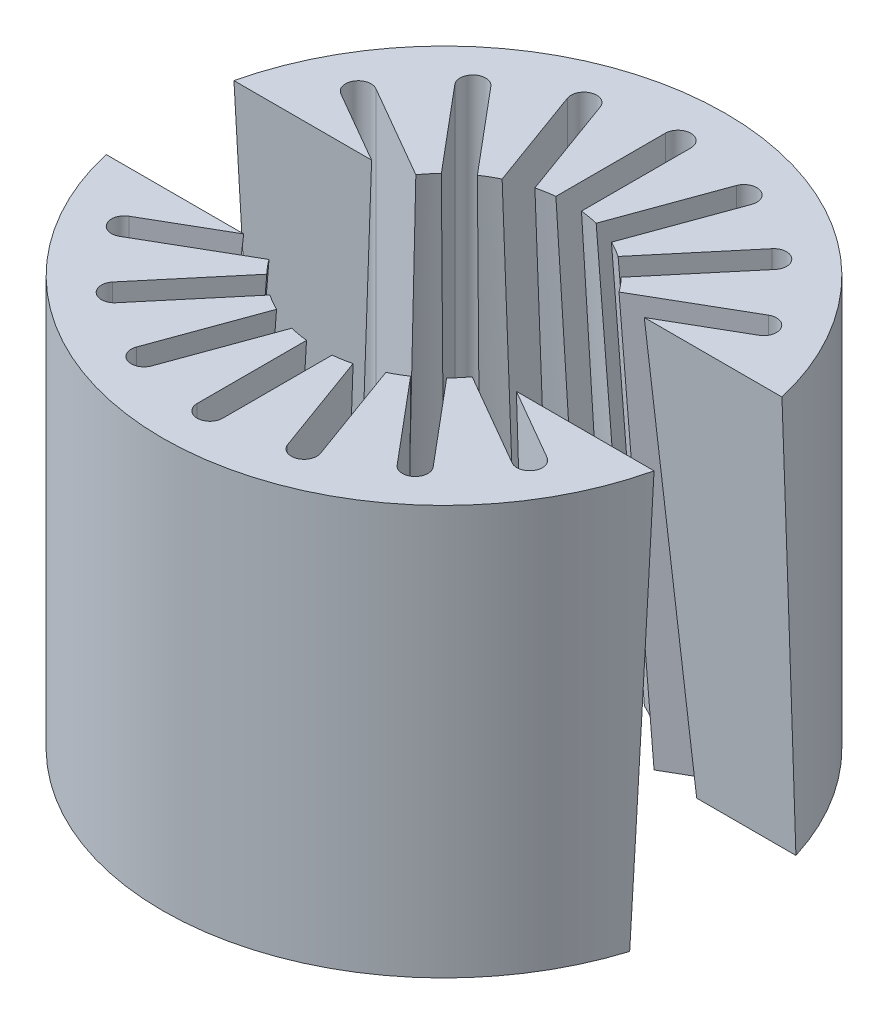
from build123d import *

# Parameters (mm, degrees)
SKETCH1_R           = 11
BOSS_EXTRUDE1_DEPTH = 16
CUT_EXTRUDE1_DEPTH  = 23.315913604
CUT_EXTRUDE2_DEPTH  = 15


with BuildPart() as part:
    # Sketch1 → Boss-Extrude1 (new body)
    with BuildSketch(Plane(origin=(0, 0, 0), x_dir=(1, 0, 0), z_dir=(0, 1, 0))):
        with Locations(Location((0, 0, 0), (0, 0, 270))):
            Circle(SKETCH1_R)
    extrude(amount=BOSS_EXTRUDE1_DEPTH)

    # Sketch2 → Cut-Revolve1 (revolve, cut)
    with BuildSketch(Plane(origin=(0, 0, 0), x_dir=(0, 0, -1), z_dir=(1, 0, 0))):
        Polygon((0, 0), (0, 16), (4.9, 16), (5.9, 0), align=None)
    revolve(axis=Axis((0, 0, 0), (0, 1, 0)), mode=Mode.SUBTRACT)

    # Sketch3 → Cut-Extrude1 (cut, through all)
    with BuildSketch(Plane(origin=(0, 16, 0), x_dir=(1, 0, 0), z_dir=(0, 1, 0))):
        with BuildLine():
            Line((-0.5, 4.8), (0.5, 4.8))
            Line((0.5, 4.8), (0.5, 9.15))
            ThreePointArc((0.5, 9.15), (0.353553391, 9.503553391), (0, 9.65))
            ThreePointArc((0, 9.65), (-0.353553391, 9.503553391), (-0.5, 9.15))
            Line((-0.5, 9.15), (-0.5, 4.8))
        make_face()
        with BuildLine():
            Line((1.171850378, 4.681534651), (2.111542998, 4.339514508))
            Line((2.111542998, 4.339514508), (3.599330622, 8.427177409))
            ThreePointArc((3.599330622, 8.427177409), (3.582638205, 8.809496611), (3.300494383, 9.068033791))
            ThreePointArc((3.300494383, 9.068033791), (2.918175181, 9.051341374), (2.659638001, 8.769197552))
            Line((2.659638001, 8.769197552), (1.171850378, 4.681534651))
        make_face()
        with BuildLine():
            Line((2.702358305, 3.998407132), (3.468402748, 3.355619522))
            Line((3.468402748, 3.355619522), (6.26452885, 6.68791285))
            ThreePointArc((6.26452885, 6.68791285), (6.379603978, 7.052884526), (6.202900433, 7.392328876))
            ThreePointArc((6.202900433, 7.392328876), (5.837928757, 7.507404004), (5.498484407, 7.330700459))
            Line((5.498484407, 7.330700459), (2.702358305, 3.998407132))
        make_face()
        with BuildLine():
            Line((3.906921938, 2.833012702), (4.406921938, 1.966987298))
            Line((4.406921938, 1.966987298), (8.174132445, 4.141987298))
            ThreePointArc((8.174132445, 4.141987298), (8.407095358, 4.445590477), (8.357145147, 4.825))
            ThreePointArc((8.357145147, 4.825), (8.053541967, 5.057962913), (7.674132445, 5.008012702))
            Line((7.674132445, 5.008012702), (3.906921938, 2.833012702))
        make_face()
        with BuildLine():
            Line((4.640253126, 1.325915129), (4.813901303, 0.341107376))
            Line((4.813901303, 0.341107376), (9.097815029, 1.096476949))
            ThreePointArc((9.097815029, 1.096476949), (9.420566962, 1.302092607), (9.503394817, 1.675704914))
            ThreePointArc((9.503394817, 1.675704914), (9.297779158, 1.998456848), (8.924166851, 2.081284702))
            Line((8.924166851, 2.081284702), (4.640253126, 1.325915129))
        make_face()
        with BuildLine():
            Line((4.813901303, -0.341107376), (4.640253126, -1.325915129))
            Line((4.640253126, -1.325915129), (8.924166851, -2.081284702))
            ThreePointArc((8.924166851, -2.081284702), (9.297779158, -1.998456848), (9.503394817, -1.675704914))
            ThreePointArc((9.503394817, -1.675704914), (9.420566962, -1.302092607), (9.097815029, -1.096476949))
            Line((9.097815029, -1.096476949), (4.813901303, -0.341107376))
        make_face()
        with BuildLine():
            Line((4.406921938, -1.966987298), (3.906921938, -2.833012702))
            Line((3.906921938, -2.833012702), (7.674132445, -5.008012702))
            ThreePointArc((7.674132445, -5.008012702), (8.053541967, -5.057962913), (8.357145147, -4.825))
            ThreePointArc((8.357145147, -4.825), (8.407095358, -4.445590477), (8.174132445, -4.141987298))
            Line((8.174132445, -4.141987298), (4.406921938, -1.966987298))
        make_face()
        with BuildLine():
            Line((3.468402748, -3.355619522), (2.702358305, -3.998407132))
            Line((2.702358305, -3.998407132), (5.498484407, -7.330700459))
            ThreePointArc((5.498484407, -7.330700459), (5.837928757, -7.507404004), (6.202900433, -7.392328876))
            ThreePointArc((6.202900433, -7.392328876), (6.379603978, -7.052884526), (6.26452885, -6.68791285))
            Line((6.26452885, -6.68791285), (3.468402748, -3.355619522))
        make_face()
        with BuildLine():
            Line((2.111542998, -4.339514508), (1.171850378, -4.681534651))
            Line((1.171850378, -4.681534651), (2.659638001, -8.769197552))
            ThreePointArc((2.659638001, -8.769197552), (2.918175181, -9.051341374), (3.300494383, -9.068033791))
            ThreePointArc((3.300494383, -9.068033791), (3.582638205, -8.809496611), (3.599330622, -8.427177409))
            Line((3.599330622, -8.427177409), (2.111542998, -4.339514508))
        make_face()
        with BuildLine():
            Line((0.5, -4.8), (-0.5, -4.8))
            Line((-0.5, -4.8), (-0.5, -9.15))
            ThreePointArc((-0.5, -9.15), (-0.353553391, -9.503553391), (0, -9.65))
            ThreePointArc((0, -9.65), (0.353553391, -9.503553391), (0.5, -9.15))
            Line((0.5, -9.15), (0.5, -4.8))
        make_face()
        with BuildLine():
            Line((-1.171850378, -4.681534651), (-2.111542998, -4.339514508))
            Line((-2.111542998, -4.339514508), (-3.599330622, -8.427177409))
            ThreePointArc((-3.599330622, -8.427177409), (-3.582638205, -8.809496611), (-3.300494383, -9.068033791))
            ThreePointArc((-3.300494383, -9.068033791), (-2.918175181, -9.051341374), (-2.659638001, -8.769197552))
            Line((-2.659638001, -8.769197552), (-1.171850378, -4.681534651))
        make_face()
        with BuildLine():
            Line((-2.702358305, -3.998407132), (-3.468402748, -3.355619522))
            Line((-3.468402748, -3.355619522), (-6.26452885, -6.68791285))
            ThreePointArc((-6.26452885, -6.68791285), (-6.379603978, -7.052884526), (-6.202900433, -7.392328876))
            ThreePointArc((-6.202900433, -7.392328876), (-5.837928757, -7.507404004), (-5.498484407, -7.330700459))
            Line((-5.498484407, -7.330700459), (-2.702358305, -3.998407132))
        make_face()
        with BuildLine():
            Line((-3.906921938, -2.833012702), (-4.406921938, -1.966987298))
            Line((-4.406921938, -1.966987298), (-8.174132445, -4.141987298))
            ThreePointArc((-8.174132445, -4.141987298), (-8.407095358, -4.445590477), (-8.357145147, -4.825))
            ThreePointArc((-8.357145147, -4.825), (-8.053541967, -5.057962913), (-7.674132445, -5.008012702))
            Line((-7.674132445, -5.008012702), (-3.906921938, -2.833012702))
        make_face()
        with BuildLine():
            Line((-4.640253126, -1.325915129), (-4.813901303, -0.341107376))
            Line((-4.813901303, -0.341107376), (-9.097815029, -1.096476949))
            ThreePointArc((-9.097815029, -1.096476949), (-9.420566962, -1.302092607), (-9.503394817, -1.675704914))
            ThreePointArc((-9.503394817, -1.675704914), (-9.297779158, -1.998456848), (-8.924166851, -2.081284702))
            Line((-8.924166851, -2.081284702), (-4.640253126, -1.325915129))
        make_face()
        with BuildLine():
            Line((-4.813901303, 0.341107376), (-4.640253126, 1.325915129))
            Line((-4.640253126, 1.325915129), (-8.924166851, 2.081284702))
            ThreePointArc((-8.924166851, 2.081284702), (-9.297779158, 1.998456848), (-9.503394817, 1.675704914))
            ThreePointArc((-9.503394817, 1.675704914), (-9.420566962, 1.302092607), (-9.097815029, 1.096476949))
            Line((-9.097815029, 1.096476949), (-4.813901303, 0.341107376))
        make_face()
        with BuildLine():
            Line((-4.406921938, 1.966987298), (-3.906921938, 2.833012702))
            Line((-3.906921938, 2.833012702), (-7.674132445, 5.008012702))
            ThreePointArc((-7.674132445, 5.008012702), (-8.053541967, 5.057962913), (-8.357145147, 4.825))
            ThreePointArc((-8.357145147, 4.825), (-8.407095358, 4.445590477), (-8.174132445, 4.141987298))
            Line((-8.174132445, 4.141987298), (-4.406921938, 1.966987298))
        make_face()
        with BuildLine():
            Line((-3.468402748, 3.355619522), (-2.702358305, 3.998407132))
            Line((-2.702358305, 3.998407132), (-5.498484407, 7.330700459))
            ThreePointArc((-5.498484407, 7.330700459), (-5.837928757, 7.507404004), (-6.202900433, 7.392328876))
            ThreePointArc((-6.202900433, 7.392328876), (-6.379603978, 7.052884526), (-6.26452885, 6.68791285))
            Line((-6.26452885, 6.68791285), (-3.468402748, 3.355619522))
        make_face()
        with BuildLine():
            Line((-2.111542998, 4.339514508), (-1.171850378, 4.681534651))
            Line((-1.171850378, 4.681534651), (-2.659638001, 8.769197552))
            ThreePointArc((-2.659638001, 8.769197552), (-2.918175181, 9.051341374), (-3.300494383, 9.068033791))
            ThreePointArc((-3.300494383, 9.068033791), (-3.582638205, 8.809496611), (-3.599330622, 8.427177409))
            Line((-3.599330622, 8.427177409), (-2.111542998, 4.339514508))
        make_face()
    extrude(amount=-CUT_EXTRUDE1_DEPTH, mode=Mode.SUBTRACT)

    # Sketch4 → Cut-Extrude2 (cut, symmetric)
    with BuildSketch(Plane(origin=(0, 0, 0), x_dir=(0, 0, -1), z_dir=(1, 0, 0))):
        Polygon((0, 16), (2.5, 16), (3.25, 0), (-3.25, 0), (-2.5, 16), align=None)
    extrude(amount=CUT_EXTRUDE2_DEPTH, both=True, mode=Mode.SUBTRACT)


with BuildPart() as cut_extrude2_piece_1:
    # of the separate pieces the step leaves, piece 1, a body of its own (cut_extrude2_pieces)
    add(part.part.solids().sort_by_distance((-10.508924778, 0, 3.25))[0])


with BuildPart() as cut_extrude2_piece_2:
    # of the separate pieces the step leaves, piece 2, a body of its own (cut_extrude2_pieces)
    add(part.part.solids().sort_by_distance((10.508924778, 0, -3.25))[0])


solid = Compound([cut_extrude2_piece_1.part, cut_extrude2_piece_2.part])
